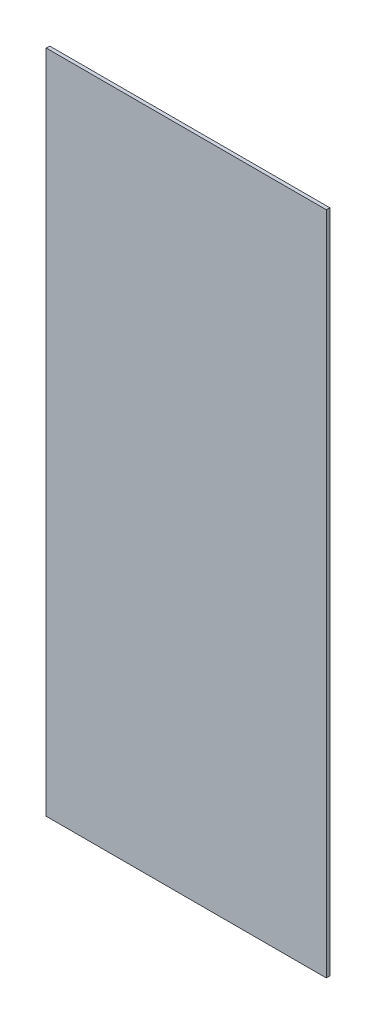
from build123d import *

# Parameters (mm, degrees)
ESQUISSE1_W        = 40
ESQUISSE1_H        = 95
BOSS_EXTRU_1_DEPTH = 0.5


with BuildPart() as part:
    # Esquisse1 → Boss.-Extru.1 (new body)
    with BuildSketch(Plane.XY):
        with Locations((20, 47.5)):
            Rectangle(ESQUISSE1_W, ESQUISSE1_H)
    extrude(amount=BOSS_EXTRU_1_DEPTH)


solid = part.part
